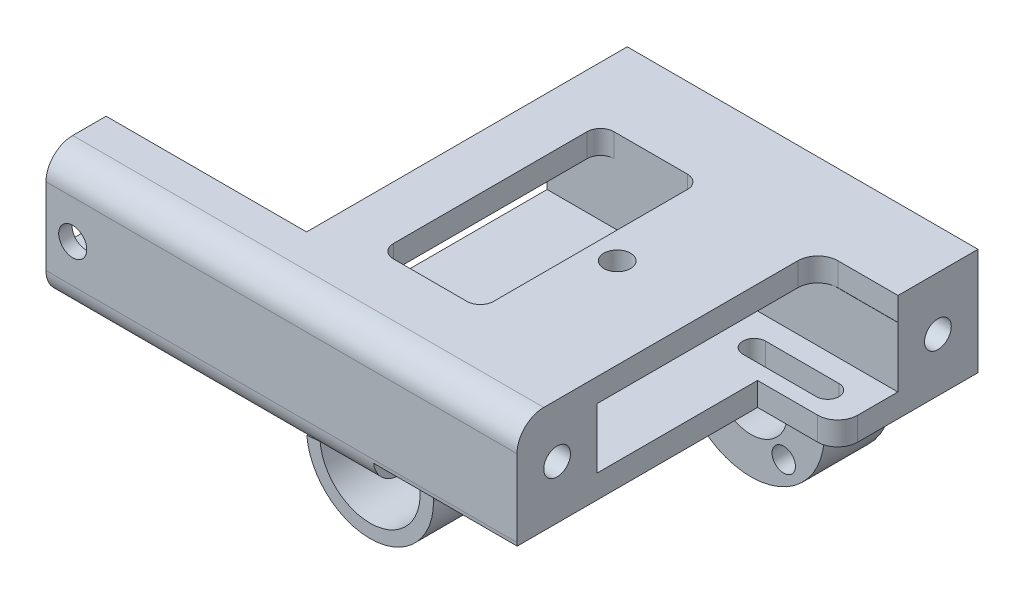
from build123d import *

# Parameters (mm, degrees)
BOSS_EXTRUDE1_DEPTH     = 57
SKETCH3_W               = 33
SKETCH3_H               = 9
SKETCH3_W_2             = 9
SKETCH3_H_2             = 15.5
CUT_EXTRUDE2_DEPTH      = 86.030876745
FILLET1_R               = 4
CUT_EXTRUDE3_DEPTH      = 86.030876745
CUT_EXTRUDE4_REACH      = 81.789
CUT_EXTRUDE5_DEPTH      = 3.5
SKETCH9_R               = 3.2
SKETCH10_R              = 2.8
CUT_EXTRUDE6_DEPTH      = 82.124903768
CUT_EXTRUDE6_DEPTH_BACK = 82.124903768
SKETCH11_R              = 2
SKETCH13_R              = 2
CUT_EXTRUDE7_DEPTH      = 20
SKETCH14_R              = 1.75
SKETCH14_R_2            = 5.5
BOSS_EXTRUDE2_DEPTH     = 10
BOSS_EXTRUDE3_DEPTH     = 30
SKETCH16_R              = 2.1
CUT_EXTRUDE8_DEPTH      = 3.4
SKETCH18_R              = 2.1
CUT_EXTRUDE9_DEPTH      = 9


with BuildPart() as part:
    # Sketch1 → Boss-Extrude1 (new body)
    with BuildSketch(Plane.XY):
        Polygon((0, 0), (0, -35), (19, -35), (19, -16), (52.5, -16), (52.5, 0), align=None)
    extrude(amount=BOSS_EXTRUDE1_DEPTH)

    # Sketch3 → Cut-Extrude2 (cut, through all)
    with BuildSketch(Plane.ZY):
        with Locations((28.5, -8)):
            Rectangle(SKETCH3_W, SKETCH3_H)
        with Locations((52.5, -27.25)):
            Rectangle(SKETCH3_W_2, SKETCH3_H_2)
    extrude(amount=-CUT_EXTRUDE2_DEPTH, mode=Mode.SUBTRACT)

    # Fillet1
    fillet1_edges = [part.edges().sort_by_distance(p)[0] for p in [
        (26.25, 0, 57),
        (9.5, -19.5, 57),
    ]]
    fillet(fillet1_edges, radius=FILLET1_R)

    # Sketch4 → Cut-Extrude3 (cut, through all)
    with BuildSketch(Plane(origin=(0, 0, 0), x_dir=(-1, 0, 0), z_dir=(0, 0, -1))):
        with BuildLine():
            Line((-0.01301942, -25.002808416), (-2.010278489, -25.107480328))
            ThreePointArc((-2.010278489, -25.107480328), (-16.998857714, -25.369106952), (-2.028539764, -26.153668071))
            Line((-2.028539764, -26.153668071), (-0.036150368, -26.327979556))
            ThreePointArc((-0.036150368, -26.327979556), (-3.081893028, -32.5041347), (-9.5, -35))
            Line((-9.5, -35), (0, -35))
            Line((0, -35), (0, -25.002053723))
            Line((0, -25.002053723), (-0.01301942, -25.002808416))
        make_face()
        with BuildLine():
            ThreePointArc((-9.5, -35), (-16.217514421, -32.217514421), (-19, -25.5))
            Line((-19, -25.5), (-19, -35))
            Line((-19, -35), (-9.5, -35))
        make_face()
    extrude(amount=-CUT_EXTRUDE3_DEPTH, mode=Mode.SUBTRACT)

    # Cut-Extrude4: up to this face of the body (flat: up to its plane)
    cut_extrude4_end = Plane(part.part.faces().sort_by_distance((26.25, -3.5, 28.5))[0])
    # Sketch5 → Cut-Extrude4 (cut, up to the picked face)
    with BuildSketch(Plane.XZ.offset(16), mode=Mode.PRIVATE) as cut_extrude4_sk1:
        with BuildLine():
            Line((47, 18.7), (36, 18.7))
            ThreePointArc((36, 18.7), (34.3, 17), (36, 15.3))
            Line((36, 15.3), (47, 15.3))
            ThreePointArc((47, 15.3), (48.7, 17), (47, 18.7))
        make_face()
    cut_extrude4_tool1 = split(extrude(cut_extrude4_sk1.sketch, amount=-CUT_EXTRUDE4_REACH, mode=Mode.PRIVATE), bisect_by=cut_extrude4_end, keep=Keep.BOTH, mode=Mode.PRIVATE)
    # Sketch5 → Cut-Extrude4 (cut, up to the picked face)
    with BuildSketch(Plane.XZ.offset(16), mode=Mode.PRIVATE) as cut_extrude4_sk2:
        with BuildLine():
            Line((40.5, 21), (49.5, 21))
            ThreePointArc((49.5, 21), (51.621320344, 20.121320344), (52.5, 18))
            Line((52.5, 18), (52.5, 57))
            Line((52.5, 57), (40.5, 57))
            Line((40.5, 57), (40.5, 21))
        make_face()
    cut_extrude4_tool2 = split(extrude(cut_extrude4_sk2.sketch, amount=-CUT_EXTRUDE4_REACH, mode=Mode.PRIVATE), bisect_by=cut_extrude4_end, keep=Keep.BOTH, mode=Mode.PRIVATE)
    add(cut_extrude4_tool1.solids().sort_by(Axis((41.5, -16, 17), (0, 1, 0)))[0], mode=Mode.SUBTRACT)
    add(cut_extrude4_tool2.solids().sort_by(Axis((46.523723, -16, 38.9169), (0, 1, 0)))[0], mode=Mode.SUBTRACT)

    # Sketch6 → Cut-Extrude5 (cut)
    with BuildSketch(Plane(origin=(0, 0, 0), x_dir=(1, 0, 0), z_dir=(0, 1, 0))):
        with BuildLine():
            Line((10, -12), (21, -12))
            ThreePointArc((21, -12), (22.414213562, -12.585786438), (23, -14))
            Line((23, -14), (23, -43))
            ThreePointArc((23, -43), (22.414213562, -44.414213562), (21, -45))
            Line((21, -45), (10, -45))
            ThreePointArc((10, -45), (8.585786438, -44.414213562), (8, -43))
            Line((8, -43), (8, -14))
            ThreePointArc((8, -14), (8.585786438, -12.585786438), (10, -12))
        make_face()
        with BuildLine():
            Line((43.5, -11.968626967), (52.5, -11.968626967))
            Line((52.5, -11.968626967), (52.5, -56.968626967))
            Line((52.5, -56.968626967), (40.5, -56.968626967))
            Line((40.5, -56.968626967), (40.5, -14.968626967))
            ThreePointArc((40.5, -14.968626967), (41.378679656, -12.847306623), (43.5, -11.968626967))
        make_face()
    extrude(amount=-CUT_EXTRUDE5_DEPTH, mode=Mode.SUBTRACT)

    # Sketch9 → Loft1 section 0
    with BuildSketch(Plane.XZ.offset(3.5)):
        with Locations((27, 28.5)):
            Circle(SKETCH9_R)
    # Sketch10 → Loft1 section 1
    with BuildSketch(Plane(origin=(0, -5, 0), x_dir=(-1, 0, 0), z_dir=(0, -1, 0))):
        with Locations((-27, -28.5)):
            Circle(SKETCH10_R)
    loft1 = loft()

    # Mirror2: Loft1 across plane
    add(loft1.mirror(Plane(origin=(0, -8, 0), x_dir=(0, 0, 1), z_dir=(0, -1, 0))))

    # Sketch11 → Cut-Extrude6 (cut, two sides: drawn at the far end of the back side and taken through both)
    with BuildSketch(Plane(origin=(0, -11, 0), x_dir=(1, 0, 0), z_dir=(0, 1, 0)).offset(-CUT_EXTRUDE6_DEPTH_BACK)):
        with Locations(Location((27, -28.5, 0), (0, 0, 270))):
            Circle(SKETCH11_R)
    extrude(amount=CUT_EXTRUDE6_DEPTH + CUT_EXTRUDE6_DEPTH_BACK, mode=Mode.SUBTRACT)

    # Sketch13 → Cut-Extrude7 (cut)
    with BuildSketch(Plane(origin=(52.5, 0, 0), x_dir=(0, 0, -1), z_dir=(1, 0, 0))):
        with Locations((-6, -8)):
            Circle(SKETCH13_R)
        with Locations((-51, -8)):
            Circle(SKETCH13_R)
    extrude(amount=-CUT_EXTRUDE7_DEPTH, mode=Mode.SUBTRACT)

    # Sketch14 → Boss-Extrude2 (add)
    # profile 1 of 2: a face of its own
    with BuildSketch(Plane(origin=(0, 0, 0), x_dir=(-1, 0, 0), z_dir=(0, 0, -1))):
        with BuildLine():
            ThreePointArc((-19, -19.954731747), (-20.721825407, -17.721825407), (-22.954731747, -16))
            Line((-22.954731747, -16), (-34.045268253, -16))
            ThreePointArc((-34.045268253, -16), (-35.581002842, -33.917802489), (-18.190789474, -29.336688458))
            ThreePointArc((-18.190789474, -29.336688458), (-18.795496221, -27.460548393), (-19, -25.5))
            Line((-19, -25.5), (-19, -19.954731747))
        make_face()
        with Locations((-33.425291803, -31.804086029)):
            Circle(SKETCH14_R, mode=Mode.SUBTRACT)
        with Locations((-22.195913971, -30.425291803)):
            Circle(SKETCH14_R, mode=Mode.SUBTRACT)
        with Locations((-34.804086029, -20.574708197)):
            Circle(SKETCH14_R, mode=Mode.SUBTRACT)
        with Locations((-28.5, -25.5)):
            Circle(SKETCH14_R_2, mode=Mode.SUBTRACT)
        with Locations((-23.574708197, -19.195913971)):
            Circle(SKETCH14_R, mode=Mode.SUBTRACT)
    # profile 2 of 2: a face of its own
    with BuildSketch(Plane(origin=(0, 0, 0), x_dir=(-1, 0, 0), z_dir=(0, 0, -1))):
        with BuildLine():
            Line((-19, -16), (-22.954731747, -16))
            ThreePointArc((-22.954731747, -16), (-20.721825407, -17.721825407), (-19, -19.954731747))
            Line((-19, -19.954731747), (-19, -16))
        make_face()
    extrude(amount=-BOSS_EXTRUDE2_DEPTH)

    # Sketch15 → Boss-Extrude3 (add)
    with BuildSketch(Plane.ZY):
        with BuildLine():
            Line((53, -19.5), (48, -19.5))
            Line((48, -19.5), (48, 0))
            Line((48, 0), (53, 0))
            ThreePointArc((53, 0), (55.828427125, -1.171572875), (57, -4))
            Line((57, -4), (57, -15.5))
            ThreePointArc((57, -15.5), (55.828427125, -18.328427125), (53, -19.5))
        make_face()
    extrude(amount=BOSS_EXTRUDE3_DEPTH)

    # Sketch16 → Cut-Extrude8 (cut)
    with BuildSketch(Plane.XY.offset(55)):
        Polygon((-30, -13.35), (-22.921539031, -13.35), (-20.843078062, -9.75), (-22.921539031, -6.15), (-30, -6.15), align=None)
        with Locations((-26, -9.75)):
            Circle(SKETCH16_R, mode=Mode.SUBTRACT)
    extrude(amount=-CUT_EXTRUDE8_DEPTH, mode=Mode.SUBTRACT)

    # Sketch18 → Cut-Extrude9 (cut)
    with BuildSketch(Plane.XY.offset(57)):
        with Locations((-26, -9.75)):
            Circle(SKETCH18_R)
    extrude(amount=-CUT_EXTRUDE9_DEPTH, mode=Mode.SUBTRACT)


solid = part.part
